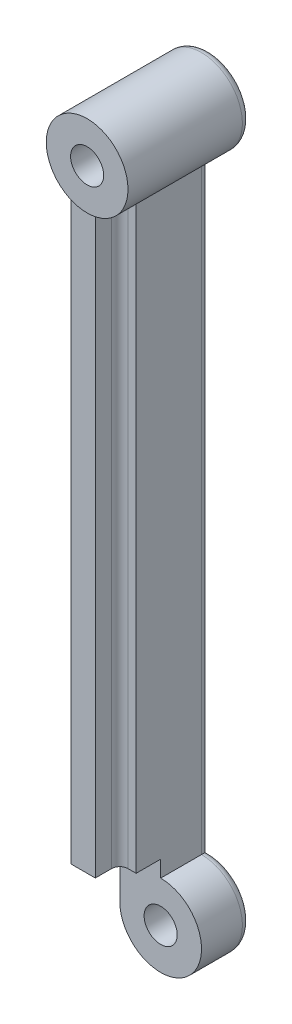
from build123d import *

# Parameters (mm, degrees)
SKETCH1_R             = 2.024999999999999
SKETCH1_R_2           = 2.025
BOSS_EXTRUDE1_DEPTH   = 9
SKETCH2_R             = 5.0000000000000036
SKETCH2_R_2           = 2.024999999999999
BOSS_EXTRUDE2_DEPTH   = 6
SKETCH3_R             = 2.025
BOSS_EXTRUDE3_DEPTH   = 3
CORTAR_EXTRUIR3_DEPTH = 10
REDONDEO1_R           = 1
REDONDEO2_R           = 1


with BuildPart() as part:
    # Sketch1 → Boss-Extrude1 (new body)
    with BuildSketch(Plane.XY):
        with BuildLine():
            Line((-4.999999999999999, 0), (-5.000000000000001, 85))
            ThreePointArc((-5.000000000000001, 85), (3.535533905932748, 88.53553390593275), (0, 79.99999999999999))
            Line((0, 79.99999999999999), (0, 5))
            ThreePointArc((0, 5), (5, 0), (0, -5))
            ThreePointArc((0, -5), (-3.5355339059327378, -3.535533905932737), (-4.999999999999999, 0))
        make_face()
        with Locations((0, 85)):
            Circle(SKETCH1_R, mode=Mode.SUBTRACT)
        Circle(SKETCH1_R_2, mode=Mode.SUBTRACT)
    extrude(amount=BOSS_EXTRUDE1_DEPTH)

    # Sketch2 → Boss-Extrude2 (add)
    with BuildSketch(Plane.XY.offset(9)):
        with Locations(Location((0, 85, 0), (0, 0, 180))):
            Circle(SKETCH2_R)
        with Locations((0, 85)):
            Circle(SKETCH2_R_2, mode=Mode.SUBTRACT)
    extrude(amount=BOSS_EXTRUDE2_DEPTH)

    # Sketch3 → Boss-Extrude3 (add)
    with BuildSketch(Plane.XY.offset(9)):
        with BuildLine():
            Line((-4.999999999999999, 0), (-5.0000000000000036, 85))
            ThreePointArc((-5.0000000000000036, 85), (-4.183300132670382, 82.26138721247418), (-2.000000000000004, 80.41742430504416))
            Line((-2.000000000000004, 80.41742430504416), (-1.9999999999999958, 5))
            Line((-1.9999999999999958, 5), (0, 5))
            ThreePointArc((0, 5), (5, 0), (0, -5))
            ThreePointArc((0, -5), (-3.535533905932738, -3.535533905932736), (-4.999999999999999, 0))
        make_face()
        Circle(SKETCH3_R, mode=Mode.SUBTRACT)
    extrude(amount=BOSS_EXTRUDE3_DEPTH)

    # Croquis1 → Cortar-Extruir3 (cut)
    with BuildSketch(Plane.ZY.offset(4.999999999999999)):
        Polygon((12, 7.011251740053792), (6, 7.011251740053791), (6.000000000000002, -5.000000000000002), (12.000000000000002, -5.000000000000001), align=None)
    extrude(amount=-CORTAR_EXTRUIR3_DEPTH, mode=Mode.SUBTRACT)

    # Redondeo1
    redondeo1_edges = [part.edges().sort_by_distance(p)[0] for p in [
        (-5, 42.5, 0),
        (3.5355339059327653, 88.53553390593274, 0),
        (0, 42.49999999999999, 0),
        (3.5355339059327386, -3.535533905932737, 0),
    ]]
    fillet(redondeo1_edges, radius=REDONDEO1_R)

    # Redondeo2
    redondeo2_edges = [part.edges().sort_by_distance(p)[0] for p in [
        (-2, 43.71433802254898, 9),
    ]]
    fillet(redondeo2_edges, radius=REDONDEO2_R)


solid = part.part
